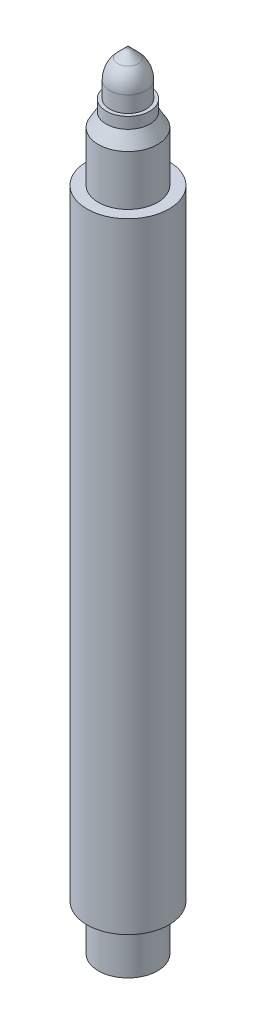
from build123d import *

# Parameters (mm, degrees)
SKETCH1_W           = 4.5
SKETCH1_H           = 68
SKETCH2_R           = 3.25
BOSS_EXTRUDE1_DEPTH = 5
BOSS_EXTRUDE2_START = 7
SKETCH3_R           = 3.25
BOSS_EXTRUDE2_DEPTH = 7
CHAMFER1_SIZE       = 1.5
CHAMFER1_SIZE2      = 0.866025404
SKETCH4_R           = 2.383974596
BOSS_EXTRUDE3_DEPTH = 1.23
FILLET1_R           = 3


with BuildPart() as part:
    # Sketch1 → Revolve1 (revolve)
    with BuildSketch(Plane.XY, mode=Mode.PRIVATE) as revolve1_sk:
        with Locations((-2.25, 0)):
            Rectangle(SKETCH1_W, SKETCH1_H)
    revolve(revolve1_sk.sketch.rotate(Axis((0, 43.52476671, 0), (0, -1, 0)), 270), axis=Axis((0, 43.52476671, 0), (0, -1, 0)))

    # Sketch2 → Boss-Extrude1 (add)
    with BuildSketch(Plane.XZ.offset(34)):
        with Locations(Location((0, 0, 0), (0, 0, 270))):
            Circle(SKETCH2_R)
    extrude(amount=BOSS_EXTRUDE1_DEPTH)

    # Sketch3 → Boss-Extrude2 (add)
    with BuildSketch(Plane(origin=(0, 34, 0), x_dir=(1, 0, 0), z_dir=(0, 1, 0)).offset(BOSS_EXTRUDE2_START)):
        with Locations(Location((0, 0, 0), (0, 0, 90))):
            Circle(SKETCH3_R)
    extrude(amount=-BOSS_EXTRUDE2_DEPTH)

    # Chamfer1
    chamfer1_edges = [part.edges().sort_by_distance(p)[0] for p in [
        (0, 41, 3.25),
    ]]
    chamfer1_side = [part.faces().sort_by_distance(p)[0] for p in [
        (0, 37.5, 3.25),
    ]]
    chamfer(chamfer1_edges, length=CHAMFER1_SIZE, length2=CHAMFER1_SIZE2, reference=chamfer1_side[0])

    # Sketch4 → Boss-Extrude3 (add)
    with BuildSketch(Plane(origin=(0, 41, 0), x_dir=(1, 0, 0), z_dir=(0, 1, 0))):
        with Locations(Location((0, 0, 0), (0, 0, 270))):
            Circle(SKETCH4_R)
    extrude(amount=BOSS_EXTRUDE3_DEPTH)

    # Sketch5 → Revolve2 (revolve)
    with BuildSketch(Plane(origin=(0, 0, 0), x_dir=(0, 0, -1), z_dir=(1, 0, 0))):
        Polygon((0, 47.23), (-2, 45.23), (-2, 42.23), (0, 42.23), align=None)
    revolve(axis=Axis((0, 53.154384726, 0), (0, -1, 0)))

    # Fillet1
    fillet1_edges = [part.edges().sort_by_distance(p)[0] for p in [
        (0, 45.23, -2),
    ]]
    fillet(fillet1_edges, radius=FILLET1_R)


with BuildPart() as part_1:
    # Body-Move/Copy1: moved
    add(part.part.moved(Location((0, -47.23, 0))))


solid = part_1.part
